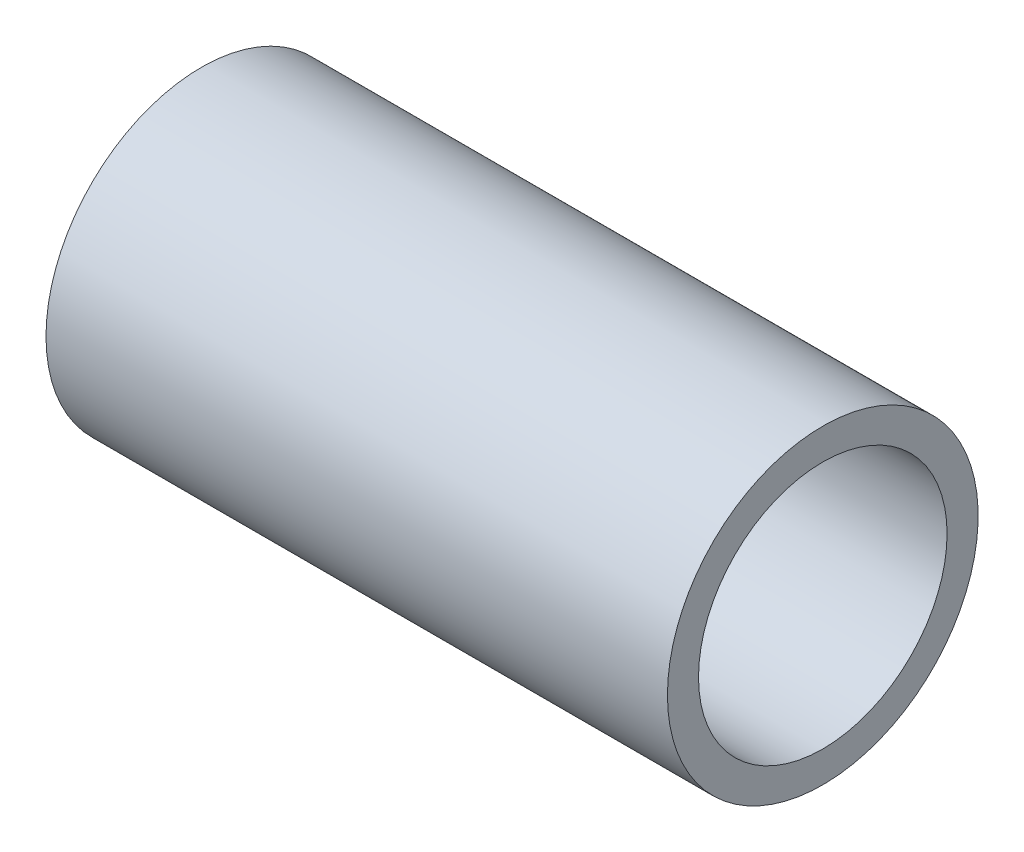
from build123d import *


with BuildPart() as part:
    # Skizze1 → Rotation1 (revolve)
    with BuildSketch(Plane.XY, mode=Mode.PRIVATE) as rotation1_sk:
        Polygon((0, 50), (0, 32.5), (5, 32.5), (5, 34.7), (8, 34.7), (8, 32.5), (20, 32.5), (20, 34.7), (23, 34.7), (23, 32.5), (30, 32.5), (30, 40), (200, 40), (200, 50), align=None)
    revolve(rotation1_sk.sketch.rotate(Axis((0, 0, 0), (1, 0, 0)), 90), axis=Axis((0, 0, 0), (1, 0, 0)))


solid = part.part
